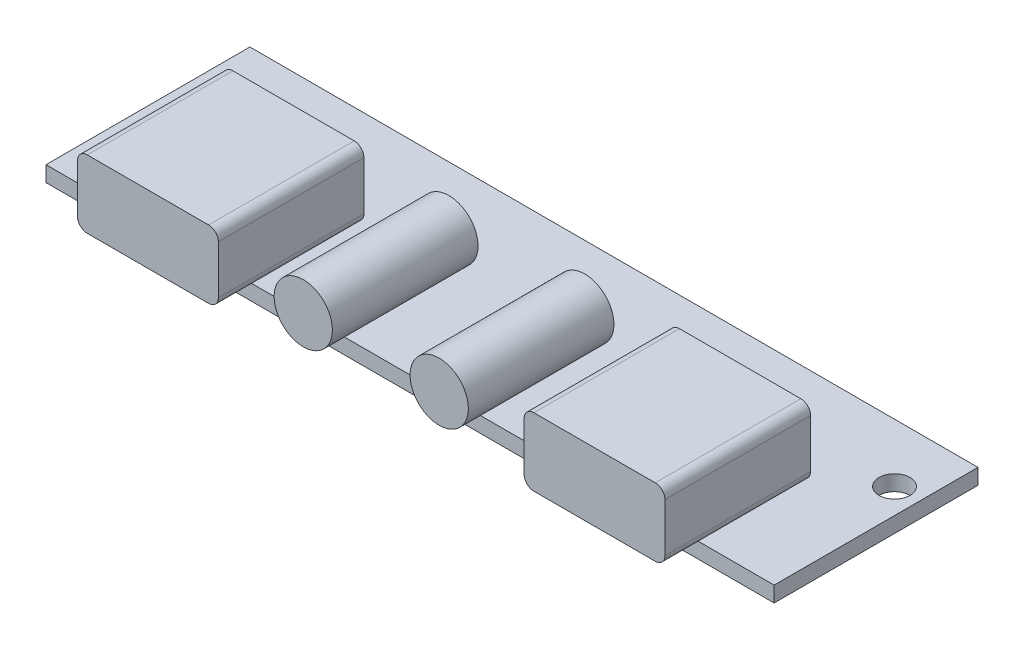
from build123d import *

# Parameters (mm, degrees)
SKETCH1_W                     = 75
SKETCH1_H                     = 21
BOSS_EXTRUDE1_DEPTH           = 1.6
SKETCH2_R                     = 3
BOSS_EXTRUDE2_DEPTH           = 15
BOSS_EXTRUDE2_2_DEPTH         = 15
SKETCH4_W                     = 1.6
SKETCH4_H                     = 1.6
M3_CLEARANCE_HOLE1_AT_2_COUNT = 2
M3_CLEARANCE_HOLE1_AT_2_PITCH = 69.8


with BuildPart() as part:
    # Sketch1 → Boss-Extrude1 (new body)
    with BuildSketch(Plane(origin=(0, 0, 0), x_dir=(1, 0, 0), z_dir=(0, 1, 0))):
        Rectangle(SKETCH1_W, SKETCH1_H)
    extrude(amount=BOSS_EXTRUDE1_DEPTH)

    # Sketch4 → M3 Clearance Hole1 (revolve, cut)
    with BuildSketch(Plane(origin=(-34.9, 1.6, -4.5), x_dir=(0, 0, 1), z_dir=(1, 0, 0))):
        with Locations((0.8, 0.8)):
            Rectangle(SKETCH4_W, SKETCH4_H)
    m3_clearance_hole1 = revolve(axis=Axis((-34.9, 7.95, -4.5), (0, -1, 0)), mode=Mode.SUBTRACT)

    # M3 Clearance Hole1 at 2: M3 Clearance Hole1 ×2
    with Locations(*[(i * M3_CLEARANCE_HOLE1_AT_2_PITCH, 0, 0) for i in range(1, M3_CLEARANCE_HOLE1_AT_2_COUNT)]):
        add(m3_clearance_hole1, mode=Mode.SUBTRACT)


with BuildPart() as body_2:
    # Sketch2 → Boss-Extrude2 (new body)
    with BuildSketch(Plane.XY.offset(14.5)):
        with Locations((-7, 5.6)):
            Circle(SKETCH2_R)
    extrude(amount=-BOSS_EXTRUDE2_DEPTH)


with BuildPart() as body_3:
    # Sketch2 → Boss-Extrude2 2 (new body)
    with BuildSketch(Plane.XY.offset(14.5)):
        with BuildLine():
            Line((-29.25, 8.6), (-16.75, 8.6))
            ThreePointArc((-16.75, 8.6), (-16.042893219, 8.307106781), (-15.75, 7.6))
            Line((-15.75, 7.6), (-15.75, 2.6))
            ThreePointArc((-15.75, 2.6), (-16.042893219, 1.892893219), (-16.75, 1.6))
            Line((-16.75, 1.6), (-29.25, 1.6))
            ThreePointArc((-29.25, 1.6), (-29.957106781, 1.892893219), (-30.25, 2.6))
            Line((-30.25, 2.6), (-30.25, 7.6))
            ThreePointArc((-30.25, 7.6), (-29.957106781, 8.307106781), (-29.25, 8.6))
        make_face()
    extrude(amount=-BOSS_EXTRUDE2_2_DEPTH)


with BuildPart() as body_4:
    # Mirror13: mirrored copy
    add(body_3.part.mirror(Plane.ZY))


with BuildPart() as body_5:
    # Mirror13 2: mirrored copy
    add(body_2.part.mirror(Plane.ZY))


solid = Compound([part.part, body_2.part, body_3.part, body_4.part, body_5.part])
